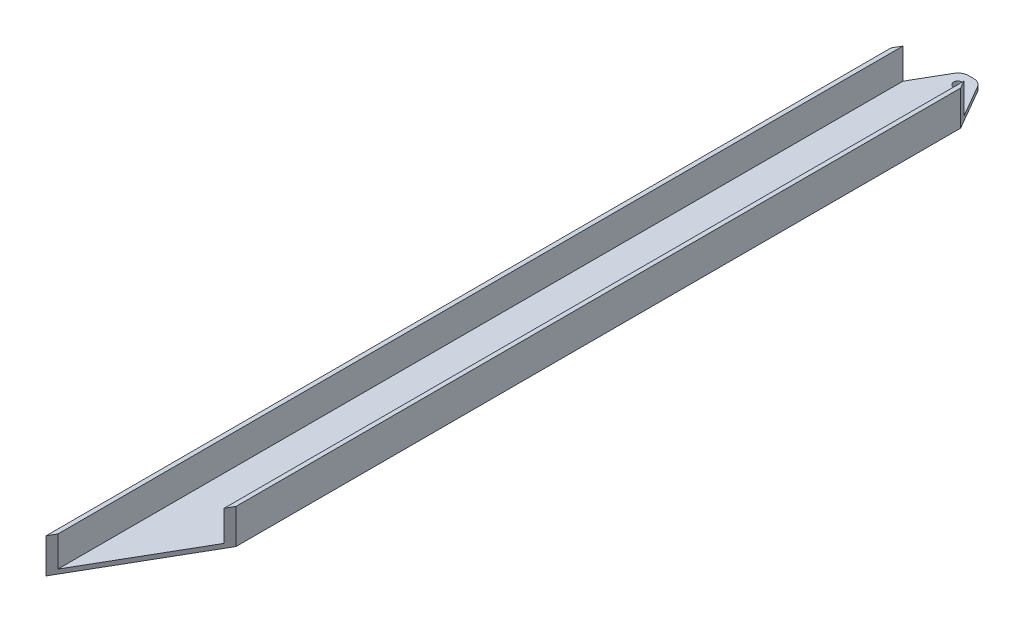
from build123d import *

# Parameters (mm, degrees)
BOSS_EXTRUDE1_DEPTH = 650.24
CUT_EXTRUDE1_DEPTH  = 652.231431674
SKETCH3_R           = 3.175
CUT_EXTRUDE2_DEPTH  = 652.231431674
FILLET1_R           = 7.62


with BuildPart() as part:
    # Sketch1 → Boss-Extrude1 (new body)
    with BuildSketch(Plane.XY):
        Polygon((-22.225, -9.525), (-22.225, 12.7), (-25.4, 12.7), (-25.4, -12.7), (25.4, -12.7), (25.4, 12.7), (22.225, 12.7), (22.225, -9.525), align=None)
    extrude(amount=BOSS_EXTRUDE1_DEPTH)

    # Sketch2 → Cut-Extrude1 (cut, through all)
    with BuildSketch(Plane.XZ.offset(12.7)):
        Polygon((-25.4, 650.24), (25.4, 562.251818976), (25.4, 650.24), align=None)
    extrude(amount=-CUT_EXTRUDE1_DEPTH, mode=Mode.SUBTRACT)

    # Sketch3 → Cut-Extrude2 (cut, through all)
    with BuildSketch(Plane(origin=(0, 12.7, 0), x_dir=(1, 0, 0), z_dir=(0, 1, 0))):
        with Locations(Location((0, -9.525, 0), (0, 0, 270))):
            Circle(SKETCH3_R)
        Polygon((-6.35, 0), (6.35, 0), (25.4, -32.995567884), (25.4, 20.936285304), (-25.4, 20.936285304), (-25.4, -32.995567884), align=None)
    extrude(amount=-CUT_EXTRUDE2_DEPTH, mode=Mode.SUBTRACT)

    # Fillet1
    fillet1_edges = [part.edges().sort_by_distance(p)[0] for p in [
        (6.35, -11.1125, 0),
        (-6.35, -11.1125, 0),
    ]]
    fillet(fillet1_edges, radius=FILLET1_R)


solid = part.part
